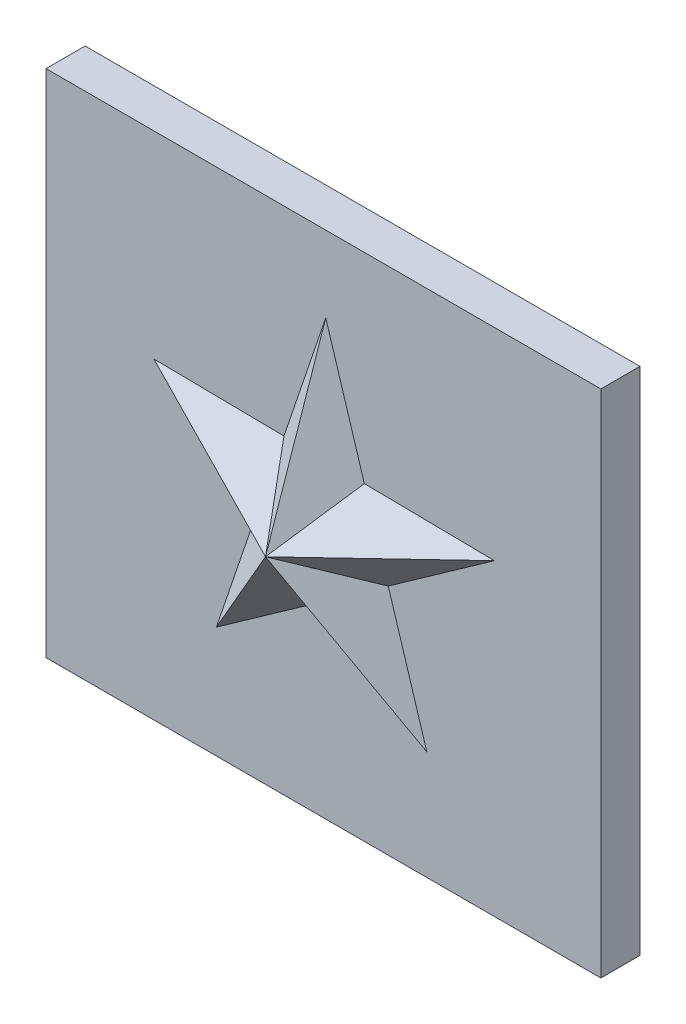
from build123d import *

# Parameters (mm, degrees)
SCALE1_SCALE        = 0.222222222
SKETCH5_W           = 42.55
SKETCH5_H           = 39.12
BOSS_EXTRUDE1_DEPTH = 3


with BuildPart() as part:
    # Sketch2 → Loft1 section 0
    with BuildSketch(Plane.XY, mode=Mode.PRIVATE) as loft1_s0:
        with BuildLine():
            Line((0.798818744, 61.79823623), (-13.627719918, 19.2760512))
            Line((-13.627719918, 19.2760512), (-58.526766695, 19.856426989))
            Line((-58.526766695, 19.856426989), (-22.543811151, -7.004104425))
            Line((-22.543811151, -7.004104425), (-36.970349813, -49.526289455))
            Line((-36.970349813, -49.526289455), (-0.305121609, -23.604825795))
            Line((-0.305121609, -23.604825795), (35.677833934, -50.465357209))
            Line((35.677833934, -50.465357209), (22.355235626, -7.584480215))
            Line((22.355235626, -7.584480215), (59.020463829, 18.336983445))
            Line((59.020463829, 18.336983445), (14.121417053, 18.917359235))
            Line((14.121417053, 18.917359235), (0.798818744, 61.79823623))
        make_face()
    loft([loft1_s0.sketch, Vertex(0, 0, 20)])


with BuildPart() as part_1:
    # Scale1: scaled about (0, 0, 0)
    add(part.part.scale(SCALE1_SCALE))

    # Sketch5 → Boss-Extrude1 (add)
    with BuildSketch(Plane(origin=(0, 0, 0), x_dir=(-1, 0, 0), z_dir=(0, 0, -1))):
        Rectangle(SKETCH5_W, SKETCH5_H)
    extrude(amount=BOSS_EXTRUDE1_DEPTH)


solid = part_1.part
